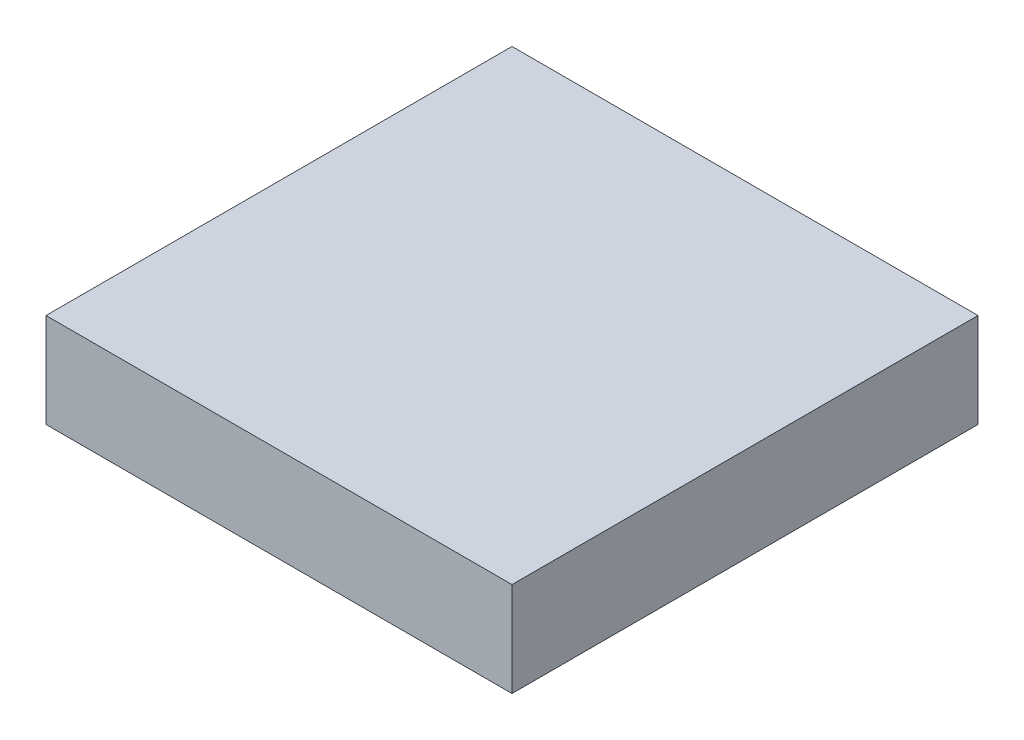
from build123d import *

# Parameters (mm, degrees)
SKETCH_1_W          = 15.8
SKETCH_1_H          = 15.8
EXTRUDE_1_DEPTH     = 3.2
SKETCH_1_5_R        = 2.5
CUT_EXTRUDE_1_DEPTH = 1.8


with BuildPart() as part:
    # Эскиз1 → Бобышка-Вытянуть1 (new body)
    with BuildSketch(Plane(origin=(0, 0, 0), x_dir=(1, 0, 0), z_dir=(0, 1, 0))):
        Rectangle(SKETCH_1_W, SKETCH_1_H)
    extrude(amount=EXTRUDE_1_DEPTH)

    # Эскиз1<5> → Вырез-Вытянуть1 (cut)
    with BuildSketch(Plane(origin=(0, 0, 0), x_dir=(1, 0, 0), z_dir=(0, 1, 0))):
        with Locations((4, 4)):
            Circle(SKETCH_1_5_R)
        with Locations((-4, 4)):
            Circle(SKETCH_1_5_R)
        with Locations((-4, -4)):
            Circle(SKETCH_1_5_R)
        with Locations((4, -4)):
            Circle(SKETCH_1_5_R)
    extrude(amount=CUT_EXTRUDE_1_DEPTH, mode=Mode.SUBTRACT)


solid = part.part
